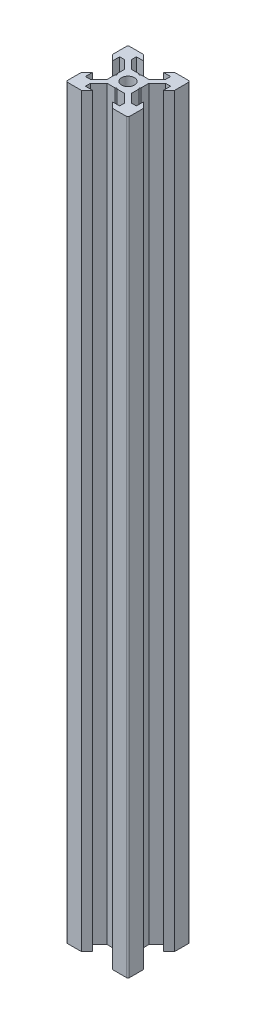
from build123d import *

# Parameters (mm, degrees)
SKETCH_28_R         = 2.075
EXTRUDE_2020V_DEPTH = 240


with BuildPart() as part:
    # 草图28 → 2020V (new body)
    with BuildSketch(Plane(origin=(0, 0, 0), x_dir=(1, 0, 0), z_dir=(0, 1, 0))):
        with BuildLine():
            Line((-3.900000395, 2.839340223), (-3.900000395, 0.282843107))
            Line((-3.900000395, 0.282843107), (-3.617157288, 0))
            Line((-3.617157288, 0), (-3.9, -0.282842712))
            Line((-3.9, -0.282842712), (-3.9, -2.839339828))
            Line((-3.9, -2.839339828), (-6.560660172, -5.5))
            Line((-6.560660172, -5.5), (-8.2, -5.5))
            Line((-8.2, -5.5), (-8.2, -3.150000255))
            Line((-8.2, -3.150000255), (-10, -4.950000255))
            Line((-10, -4.950000255), (-10, -9.5))
            ThreePointArc((-10, -9.5), (-9.853553391, -9.853553391), (-9.5, -10))
            Line((-9.5, -10), (-4.950000255, -10))
            Line((-4.950000255, -10), (-3.150000255, -8.2))
            Line((-3.150000255, -8.2), (-5.5, -8.2))
            Line((-5.5, -8.2), (-5.5, -6.560660172))
            Line((-5.5, -6.560660172), (-2.839339828, -3.9))
            Line((-2.839339828, -3.9), (-0.282842712, -3.9))
            Line((-0.282842712, -3.9), (0, -3.617157288))
            Line((0, -3.617157288), (0.282842712, -3.9))
            Line((0.282842712, -3.9), (2.839339828, -3.9))
            Line((2.839339828, -3.9), (5.5, -6.560660172))
            Line((5.5, -6.560660172), (5.5, -8.2))
            Line((5.5, -8.2), (3.150000255, -8.2))
            Line((3.150000255, -8.2), (4.950000255, -10))
            Line((4.950000255, -10), (9.5, -10))
            ThreePointArc((9.5, -10), (9.853553391, -9.853553391), (10, -9.5))
            Line((10, -9.5), (10, -4.950000255))
            Line((10, -4.950000255), (8.2, -3.150000255))
            Line((8.2, -3.150000255), (8.2, -5.5))
            Line((8.2, -5.5), (6.560660172, -5.5))
            Line((6.560660172, -5.5), (3.9, -2.839339828))
            Line((3.9, -2.839339828), (3.9, -0.282842712))
            Line((3.9, -0.282842712), (3.617157288, 0))
            Line((3.617157288, 0), (3.900000116, 0.282842829))
            Line((3.900000116, 0.282842829), (3.900000116, 2.839339944))
            Line((3.900000116, 2.839339944), (6.560660288, 5.500000116))
            Line((6.560660288, 5.500000116), (8.200000116, 5.500000116))
            Line((8.200000116, 5.500000116), (8.200000116, 3.150000371))
            Line((8.200000116, 3.150000371), (10.000000116, 4.950000371))
            Line((10.000000116, 4.950000371), (10.000000116, 9.499999884))
            ThreePointArc((10.000000116, 9.499999884), (9.853553507, 9.853553275), (9.500000116, 9.999999884))
            Line((9.500000116, 9.999999884), (4.950000139, 9.999999884))
            Line((4.950000139, 9.999999884), (3.150000139, 8.199999884))
            Line((3.150000139, 8.199999884), (5.499999884, 8.199999884))
            Line((5.499999884, 8.199999884), (5.499999884, 6.560660056))
            Line((5.499999884, 6.560660056), (2.839339712, 3.899999884))
            Line((2.839339712, 3.899999884), (0.282842991, 3.899999884))
            Line((0.282842991, 3.899999884), (0, 3.617156893))
            Line((0, 3.617156893), (-0.282842712, 3.899999605))
            Line((-0.282842712, 3.899999605), (-2.839339434, 3.899999605))
            Line((-2.839339434, 3.899999605), (-5.499999605, 6.560659777))
            Line((-5.499999605, 6.560659777), (-5.499999605, 8.199999605))
            Line((-5.499999605, 8.199999605), (-3.149999861, 8.199999605))
            Line((-3.149999861, 8.199999605), (-4.949999861, 9.999999605))
            Line((-4.949999861, 9.999999605), (-9.500000395, 9.999999605))
            ThreePointArc((-9.500000395, 9.999999605), (-9.853553785, 9.853552996), (-10.000000395, 9.499999605))
            Line((-10.000000395, 9.499999605), (-10.000000395, 4.95000065))
            Line((-10.000000395, 4.95000065), (-8.200000395, 3.15000065))
            Line((-8.200000395, 3.15000065), (-8.200000395, 5.500000395))
            Line((-8.200000395, 5.500000395), (-6.560660566, 5.500000395))
            Line((-6.560660566, 5.500000395), (-3.900000395, 2.839340223))
        make_face()
        with Locations(Location((0, 0, 0), (0, 0, 270))):
            Circle(SKETCH_28_R, mode=Mode.SUBTRACT)
    extrude(amount=EXTRUDE_2020V_DEPTH)


solid = part.part
